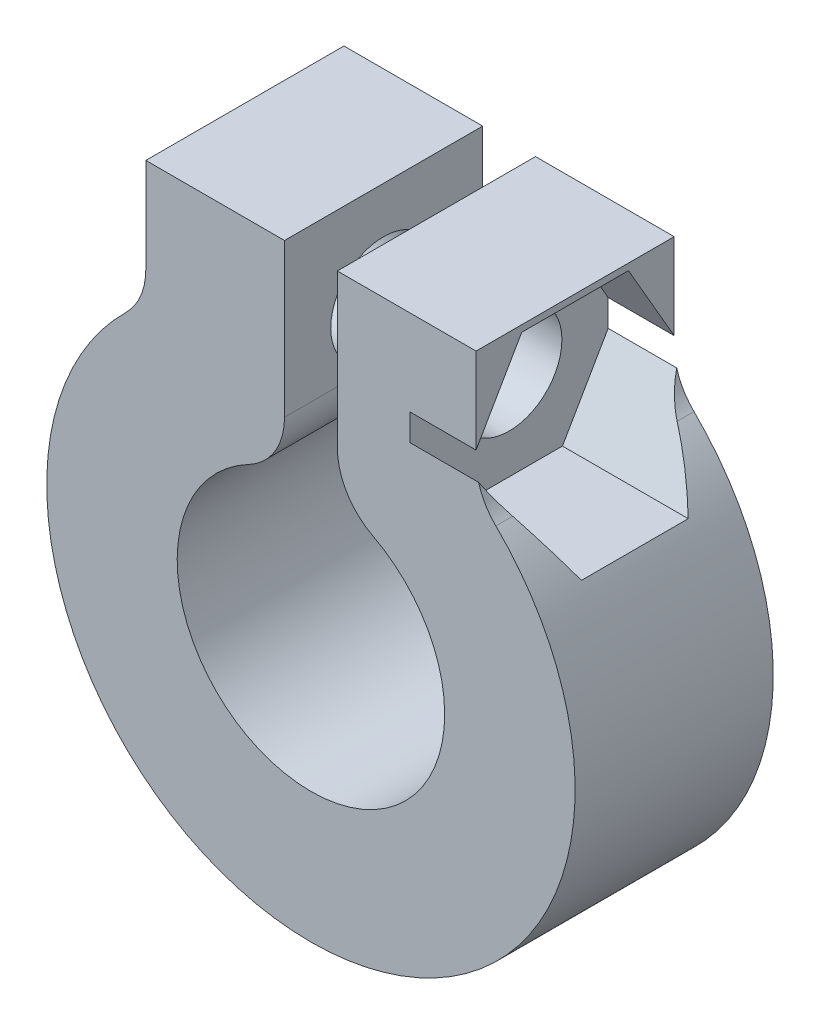
from build123d import *

# Parameters (mm, degrees)
EXTRUDE_1_DEPTH          = 6
CUT_EXTRUDE_1_DEPTH      = 18.464249197
CUT_EXTRUDE_1_DEPTH_BACK = 18.464249197
SKETCH_2_R               = 1.6
SKETCH_3_R               = 2.8
CUT_EXTRUDE_2_DEPTH      = 17.733200638
CUT_EXTRUDE_3_DEPTH      = 17.031219648


with BuildPart() as part:
    # 草图1 → 凸台-拉伸1 (new body)
    with BuildSketch(Plane.XY):
        with BuildLine():
            Line((-5, 7.141428429), (-5, 10))
            Line((-5, 10), (-0.8, 10))
            Line((-0.8, 10), (-0.8, 5.363068152))
            ThreePointArc((-0.8, 5.363068152), (-1.089555662, 4.326545038), (-1.874380165, 3.59015306))
            ThreePointArc((-1.874380165, 3.59015306), (0, -4.05), (1.874380165, 3.59015306))
            ThreePointArc((1.874380165, 3.59015306), (1.089555662, 4.326545038), (0.8, 5.363068152))
            Line((0.8, 5.363068152), (0.8, 10))
            Line((0.8, 10), (5, 10))
            Line((5, 10), (5, 7.141428429))
            ThreePointArc((5, 7.141428429), (5.156091109, 6.366831759), (5.6, 5.713142743))
            ThreePointArc((5.6, 5.713142743), (0, -8), (-5.6, 5.713142743))
            ThreePointArc((-5.6, 5.713142743), (-5.156091109, 6.366831759), (-5, 7.141428429))
        make_face()
    extrude(amount=EXTRUDE_1_DEPTH)

    # 草图2 → 切除-拉伸1 (cut, two sides: drawn at the far end of the back side and taken through both)
    with BuildSketch(Plane.ZY.offset(5).offset(-CUT_EXTRUDE_1_DEPTH_BACK)):
        with Locations(Location((3, 7, 0), (0, 0, 5.071150936))):
            Circle(SKETCH_2_R)
    extrude(amount=CUT_EXTRUDE_1_DEPTH + CUT_EXTRUDE_1_DEPTH_BACK, mode=Mode.SUBTRACT)

    # 草图3 → 切除-拉伸2 (cut, through all)
    with BuildSketch(Plane.ZY.offset(4)):
        with Locations(Location((3, 7, 0), (0, 0, 177.10474942))):
            Circle(SKETCH_3_R)
    extrude(amount=CUT_EXTRUDE_2_DEPTH, mode=Mode.SUBTRACT)

    # 草图4 → 切除-拉伸3 (cut, through all)
    with BuildSketch(Plane(origin=(3, 0, 0), x_dir=(0, 0, -1), z_dir=(1, 0, 0))):
        Polygon((0.233161507, 7), (-1.383419246, 9.8), (-4.616580754, 9.8), (-6.233161507, 7), (-4.616580754, 4.2), (-1.383419246, 4.2), align=None)
    extrude(amount=CUT_EXTRUDE_3_DEPTH, mode=Mode.SUBTRACT)


solid = part.part
